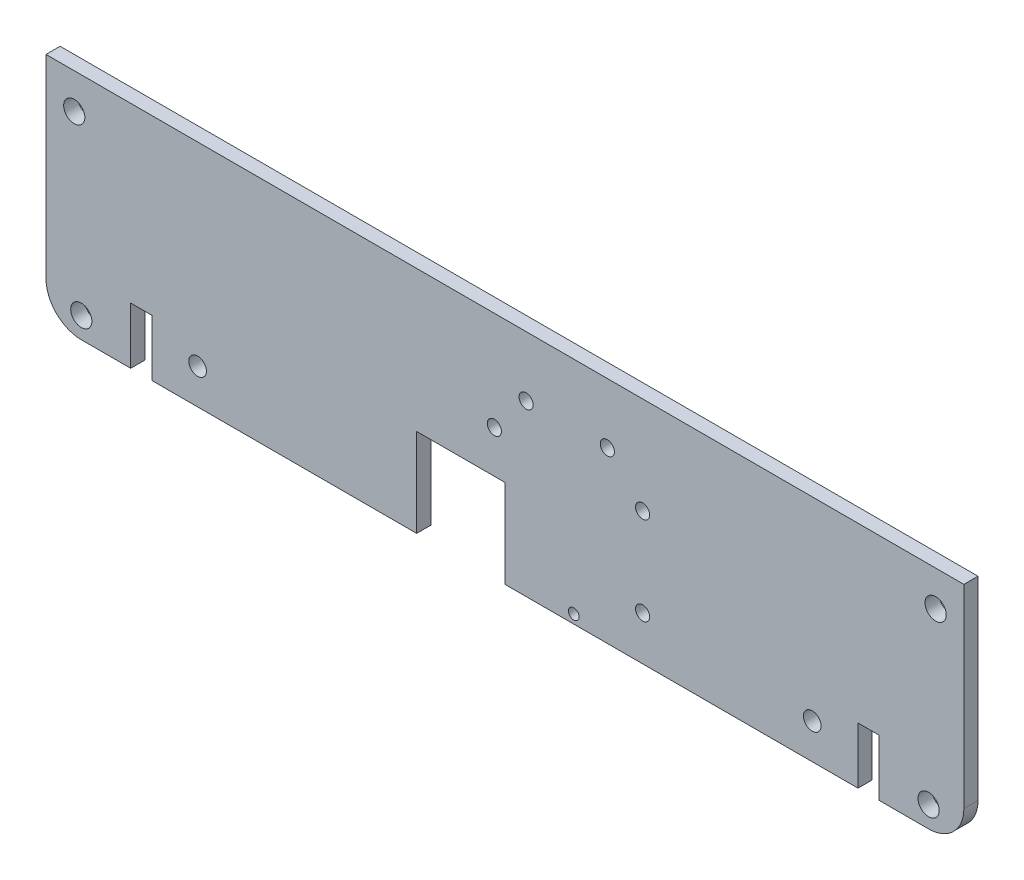
from build123d import *

# Parameters (mm, degrees)
SKETCH1_W           = 260
SKETCH1_H           = 65
BOSS_EXTRUDE2_DEPTH = 4
SKETCH3_R           = 3
CUT_EXTRUDE2_DEPTH  = 135.060620616
FILLET1_R           = 10
SKETCH4_W           = 25
SKETCH4_H           = 25
CUT_EXTRUDE3_DEPTH  = 10
SKETCH5_W           = 6
SKETCH5_H           = 16
CUT_EXTRUDE4_DEPTH  = 135.060620616
SKETCH6_R           = 2.5
CUT_EXTRUDE5_DEPTH  = 135.060620616
SKETCH7_R           = 2
SKETCH7_R_2         = 1.5
CUT_EXTRUDE6_DEPTH  = 10


with BuildPart() as part:
    # Sketch1 → Boss-Extrude2 (new body)
    with BuildSketch(Plane.XY):
        Rectangle(SKETCH1_W, SKETCH1_H)
    extrude(amount=BOSS_EXTRUDE2_DEPTH)

    # Sketch3 → Cut-Extrude2 (cut, through all)
    with BuildSketch(Plane(origin=(0, 0, 0), x_dir=(-1, 0, 0), z_dir=(0, 0, -1))):
        with Locations((120, -26.5)):
            Circle(SKETCH3_R)
        with Locations((-120, -26.5)):
            Circle(SKETCH3_R)
        with Locations((-122, 22.5)):
            Circle(SKETCH3_R)
        with Locations((122, 22.5)):
            Circle(SKETCH3_R)
    extrude(amount=-CUT_EXTRUDE2_DEPTH, mode=Mode.SUBTRACT)

    # Fillet1
    fillet1_edges = [part.edges().sort_by_distance(p)[0] for p in [
        (130, -32.5, 2),
        (-130, -32.5, 2),
    ]]
    fillet(fillet1_edges, radius=FILLET1_R)

    # Sketch4 → Cut-Extrude3 (cut)
    with BuildSketch(Plane(origin=(0, 0, 0), x_dir=(-1, 0, 0), z_dir=(0, 0, -1))):
        with Locations((12.5, -20)):
            Rectangle(SKETCH4_W, SKETCH4_H)
    extrude(amount=-CUT_EXTRUDE3_DEPTH, mode=Mode.SUBTRACT)

    # Sketch5 → Cut-Extrude4 (cut, through all)
    with BuildSketch(Plane(origin=(0, 0, 0), x_dir=(-1, 0, 0), z_dir=(0, 0, -1))):
        with Locations((-103, -24.5)):
            Rectangle(SKETCH5_W, SKETCH5_H)
        with Locations((103, -24.5)):
            Rectangle(SKETCH5_W, SKETCH5_H)
    extrude(amount=-CUT_EXTRUDE4_DEPTH, mode=Mode.SUBTRACT)

    # Sketch6 → Cut-Extrude5 (cut, through all)
    with BuildSketch(Plane(origin=(0, 0, 0), x_dir=(-1, 0, 0), z_dir=(0, 0, -1))):
        with Locations((87.05, -22.5)):
            Circle(SKETCH6_R)
        with Locations((-87.05, -22.5)):
            Circle(SKETCH6_R)
    extrude(amount=-CUT_EXTRUDE5_DEPTH, mode=Mode.SUBTRACT)

    # Sketch7 → Cut-Extrude6 (cut)
    with BuildSketch(Plane(origin=(0, 0, 0), x_dir=(-1, 0, 0), z_dir=(0, 0, -1))):
        with Locations((-39, -20)):
            Circle(SKETCH7_R)
        with Locations((-39, 5)):
            Circle(SKETCH7_R)
        with Locations((-29, 15.5)):
            Circle(SKETCH7_R)
        with Locations((-6, 15.5)):
            Circle(SKETCH7_R)
        with Locations((3, 4.5)):
            Circle(SKETCH7_R)
        with Locations((-19.5, -30)):
            Circle(SKETCH7_R_2)
    extrude(amount=-CUT_EXTRUDE6_DEPTH, mode=Mode.SUBTRACT)


solid = part.part
